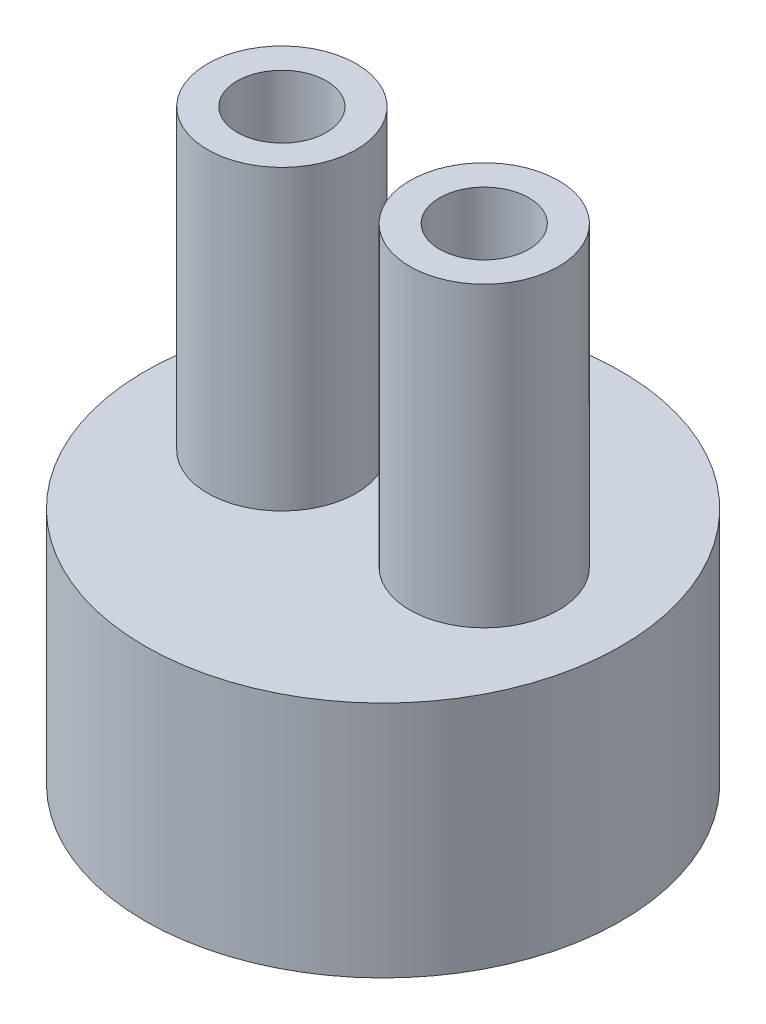
from build123d import *

# Parameters (mm, degrees)
SHELL1_T              = -2.54
SKETCH5_R             = 3.175
SKETCH5_R_2           = 1.905
BOSS_EXTRUDE1_DEPTH   = 15.24
BOSS_EXTRUDE1_2_DEPTH = 15.24
CUT_EXTRUDE1_REACH    = 31.116
SKETCH6_R             = 3.392080707
SKETCH7_R             = 10.16
SKETCH7_R_2           = 3.175
BOSS_EXTRUDE2_DEPTH   = 2.54


with BuildPart() as part:
    # Sketch4 → Revolve1 (revolve)
    with BuildSketch(Plane(origin=(0, 0, 0), x_dir=(0, 0, -1), z_dir=(1, 0, 0))):
        Polygon((0, 0), (-3.392080707, 0), (-10.16, 2.463321171), (-10.16, 10.083321171), (0, 10.083321171), align=None)
    revolve(axis=Axis((0, 10.083321171, 0), (0, -1, 0)))

    # Shell1
    shell1_openings = [part.faces().sort_by_distance(p)[0] for p in [
        (0, 10.083321171, 0),
    ]]
    offset(amount=SHELL1_T, openings=shell1_openings, kind=Kind.INTERSECTION)

    # Cut-Extrude1: up to this cone (the profile starts outside it)
    cut_extrude1_end = Plane(origin=(0, 0, 0), z_dir=(0, 1, 0)).offset(1.468396133) * Cone(2.747e-06, 82.829863624, 30.147603867, align=(Align.CENTER, Align.CENTER, Align.MIN), mode=Mode.PRIVATE)
    # Sketch6 → Cut-Extrude1 (cut, up to the surface)
    with BuildSketch(Plane.XZ, mode=Mode.PRIVATE) as cut_extrude1_sk1:
        with Locations(Location((0, 0, 0), (0, 0, 90))):
            Circle(SKETCH6_R)
    cut_extrude1_tool1 = extrude(cut_extrude1_sk1.sketch, amount=-CUT_EXTRUDE1_REACH, mode=Mode.PRIVATE) - cut_extrude1_end
    add(cut_extrude1_tool1.solids().sort_by_distance((0, 0, 0))[0], mode=Mode.SUBTRACT)


with BuildPart() as body_2:
    # Sketch5 → Boss-Extrude1 (new body)
    with BuildSketch(Plane(origin=(0, 10.083321171, 0), x_dir=(1, 0, 0), z_dir=(0, 1, 0))):
        with Locations(Location((-4.318, 0, 0), (0, 0, 90))):
            Circle(SKETCH5_R)
        with Locations(Location((-4.318, 0, 0), (0, 0, 90))):
            Circle(SKETCH5_R_2, mode=Mode.SUBTRACT)
    extrude(amount=BOSS_EXTRUDE1_DEPTH)



with BuildPart() as body_3:
    # Sketch5 → Boss-Extrude1 2 (new body)
    with BuildSketch(Plane(origin=(0, 10.083321171, 0), x_dir=(1, 0, 0), z_dir=(0, 1, 0))):
        with Locations(Location((4.318, 0, 0), (0, 0, 90))):
            Circle(SKETCH5_R)
        with Locations(Location((4.318, 0, 0), (0, 0, 90))):
            Circle(SKETCH5_R_2, mode=Mode.SUBTRACT)
    extrude(amount=BOSS_EXTRUDE1_2_DEPTH)


with BuildPart() as cut_extrude1_kept_piece:
    # of the separate pieces the step leaves, the one the design keeps (cut_extrude1_pieces_kept)
    add(part.part.solids().sort_by_distance((0, 0, 3.392080707))[0])


with BuildPart() as body_2_1:
    add(body_2.part)

    add(body_3.part)  # Boss-Extrude2 merges body 3

    add(cut_extrude1_kept_piece.part)  # Boss-Extrude2 merges Cut-Extrude1 kept piece
    # Sketch7 → Boss-Extrude2 (add)
    with BuildSketch(Plane(origin=(0, 10.083321171, 0), x_dir=(1, 0, 0), z_dir=(0, 1, 0))):
        with Locations(Location((0, 0, 0), (0, 0, 270))):
            Circle(SKETCH7_R)
        with Locations(Location((-4.318, 0, 0), (0, 0, 90))):
            Circle(SKETCH7_R_2, mode=Mode.SUBTRACT)
        with Locations(Location((4.318, 0, 0), (0, 0, 90))):
            Circle(SKETCH7_R_2, mode=Mode.SUBTRACT)
    extrude(amount=BOSS_EXTRUDE2_DEPTH)


solid = body_2_1.part
